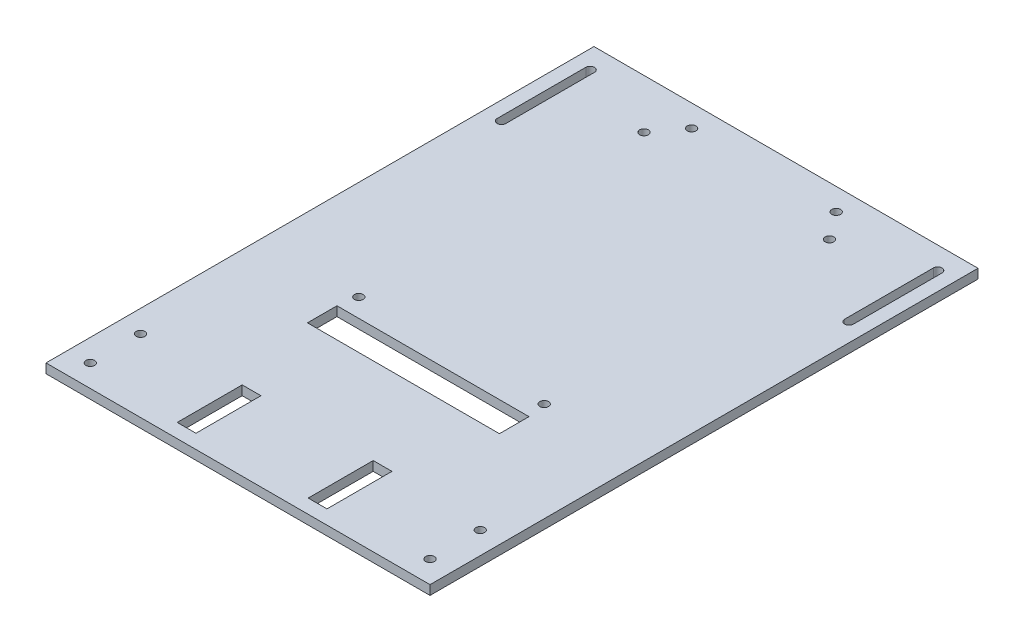
from build123d import *

# Parameters (mm, degrees)
SKETCH1_W               = 130
SKETCH1_H               = 184.5
BOSS_EXTRUDE1_DEPTH     = 3.175
SKETCH4_R               = 1.475
CUT_EXTRUDE3_DEPTH      = 113.894389254
SKETCH5_R               = 1.475
CUT_EXTRUDE4_DEPTH      = 10
SKETCH6_W               = 130
SKETCH6_H               = 3.175
BOSS_EXTRUDE2_DEPTH     = 1
CUT_EXTRUDE5_DEPTH      = 114.712985736
CUT_EXTRUDE5_DEPTH_BACK = 114.712985736
SKETCH7_W               = 6.35
SKETCH7_H               = 22
SKETCH8_W               = 65
SKETCH8_H               = 10
CUT_EXTRUDE6_DEPTH      = 10
SKETCH9_R               = 1.475
CUT_EXTRUDE7_DEPTH      = 75
SKETCH10_W              = 78.139021678
SKETCH10_H              = 97.798202291
BOSS_EXTRUDE3_DEPTH     = 3.175
SKETCH11_R              = 1.475
CUT_EXTRUDE8_DEPTH      = 10


with BuildPart() as part:
    # Sketch1 → Boss-Extrude1 (new body)
    with BuildSketch(Plane(origin=(0, 0, 0), x_dir=(1, 0, 0), z_dir=(0, 1, 0))):
        Rectangle(SKETCH1_W, SKETCH1_H)
    extrude(amount=BOSS_EXTRUDE1_DEPTH)

    # Sketch4 → Cut-Extrude3 (cut, through all)
    with BuildSketch(Plane(origin=(0, 0, 0), x_dir=(-1, 0, 0), z_dir=(0, -1, 0))):
        with Locations(Location((-57.5, -84.75, 0), (0, 0, 90))):
            Circle(SKETCH4_R)
        with Locations(Location((-57.5, -67.75, 0), (0, 0, 90))):
            Circle(SKETCH4_R)
        with Locations(Location((57.5, -84.75, 0), (0, 0, 90))):
            Circle(SKETCH4_R)
        with Locations(Location((57.5, -67.75, 0), (0, 0, 90))):
            Circle(SKETCH4_R)
        with BuildLine():
            Line((-57.35, 85.775), (-57.35, 55.775))
            ThreePointArc((-57.35, 55.775), (-58.825, 54.3), (-60.3, 55.775))
            Line((-60.3, 55.775), (-60.3, 85.775))
            ThreePointArc((-60.3, 85.775), (-58.825, 87.25), (-57.35, 85.775))
        make_face()
        with BuildLine():
            Line((60.3, 85.775), (60.3, 55.775))
            ThreePointArc((60.3, 55.775), (58.825, 54.3), (57.35, 55.775))
            Line((57.35, 55.775), (57.35, 85.775))
            ThreePointArc((57.35, 85.775), (58.825, 87.25), (60.3, 85.775))
        make_face()
    extrude(amount=-CUT_EXTRUDE3_DEPTH, mode=Mode.SUBTRACT)

    # Sketch5 → Cut-Extrude4 (cut)
    with BuildSketch(Plane.XZ):
        with Locations(Location((-24.475, -85.775, 0), (0, 0, 270))):
            Circle(SKETCH5_R)
        with Locations(Location((24.475, -85.775, 0), (0, 0, 270))):
            Circle(SKETCH5_R)
    extrude(amount=-CUT_EXTRUDE4_DEPTH, mode=Mode.SUBTRACT)

    # Sketch6 → Boss-Extrude2 (add)
    with BuildSketch(Plane(origin=(0, 0, -92.25), x_dir=(-1, 0, 0), z_dir=(0, 0, -1))):
        with Locations((0, 1.5875)):
            Rectangle(SKETCH6_W, SKETCH6_H)
    extrude(amount=BOSS_EXTRUDE2_DEPTH)

    # Sketch7 → Cut-Extrude5 (cut, two sides: drawn at the far end of the back side and taken through both)
    with BuildSketch(Plane(origin=(0, 3.175, 0), x_dir=(1, 0, 0), z_dir=(0, 1, 0)).offset(-CUT_EXTRUDE5_DEPTH_BACK)):
        with Locations((-22.175, -76.48843537)):
            Rectangle(SKETCH7_W, SKETCH7_H)
        with Locations((22.175, -76.48843537)):
            Rectangle(SKETCH7_W, SKETCH7_H)
    extrude(amount=CUT_EXTRUDE5_DEPTH + CUT_EXTRUDE5_DEPTH_BACK, mode=Mode.SUBTRACT)

    # Sketch8 → Cut-Extrude6 (cut)
    with BuildSketch(Plane.XZ):
        with Locations((0, 31.25)):
            Rectangle(SKETCH8_W, SKETCH8_H)
    extrude(amount=-CUT_EXTRUDE6_DEPTH, mode=Mode.SUBTRACT)

    # Sketch9 → Cut-Extrude7 (cut)
    with BuildSketch(Plane(origin=(0, 0, 0), x_dir=(-1, 0, 0), z_dir=(0, -1, 0))):
        with BuildLine():
            ThreePointArc((-28.525, -12.75), (-28.957017498, -11.707017498), (-30, -11.275))
            Line((-30, -11.275), (-30, -12.75))
            Line((-30, -12.75), (-28.525, -12.75))
        make_face()
        with BuildLine():
            Line((-30, -12.75), (-30, -11.275))
            ThreePointArc((-30, -11.275), (-31.042982502, -13.792982502), (-28.525, -12.75))
            Line((-28.525, -12.75), (-30, -12.75))
        make_face()
        with BuildLine():
            ThreePointArc((-30, 73.775), (-28.957017498, 74.207017498), (-28.525, 75.25))
            Line((-28.525, 75.25), (-30, 75.25))
            Line((-30, 75.25), (-30, 73.775))
        make_face()
        with BuildLine():
            Line((-30, 75.25), (-28.525, 75.25))
            ThreePointArc((-28.525, 75.25), (-31.042982502, 76.292982502), (-30, 73.775))
            Line((-30, 73.775), (-30, 75.25))
        make_face()
        with Locations(Location((30, -12.75, 0), (0, 0, 90))):
            Circle(SKETCH9_R)
        with Locations(Location((30, 75.25, 0), (0, 0, 90))):
            Circle(SKETCH9_R)
    extrude(amount=-CUT_EXTRUDE7_DEPTH, mode=Mode.SUBTRACT)

    # Sketch10 → Boss-Extrude3 (add)
    with BuildSketch(Plane(origin=(0, 0, 0), x_dir=(-1, 0, 0), z_dir=(0, -1, 0))):
        with Locations((-1.9908031, 30.735322083)):
            Rectangle(SKETCH10_W, SKETCH10_H)
    extrude(amount=-BOSS_EXTRUDE3_DEPTH)

    # Sketch11 → Cut-Extrude8 (cut)
    with BuildSketch(Plane(origin=(0, 0, 0), x_dir=(-1, 0, 0), z_dir=(0, -1, 0))):
        with Locations(Location((31.39, -19.98, 0), (0, 0, 90))):
            Circle(SKETCH11_R)
        with Locations(Location((31.39, 76.57, 0), (0, 0, 90))):
            Circle(SKETCH11_R)
        with Locations(Location((-31.39, -19.98, 0), (0, 0, 90))):
            Circle(SKETCH11_R)
        with Locations(Location((-31.39, 76.57, 0), (0, 0, 90))):
            Circle(SKETCH11_R)
    extrude(amount=-CUT_EXTRUDE8_DEPTH, mode=Mode.SUBTRACT)


solid = part.part
